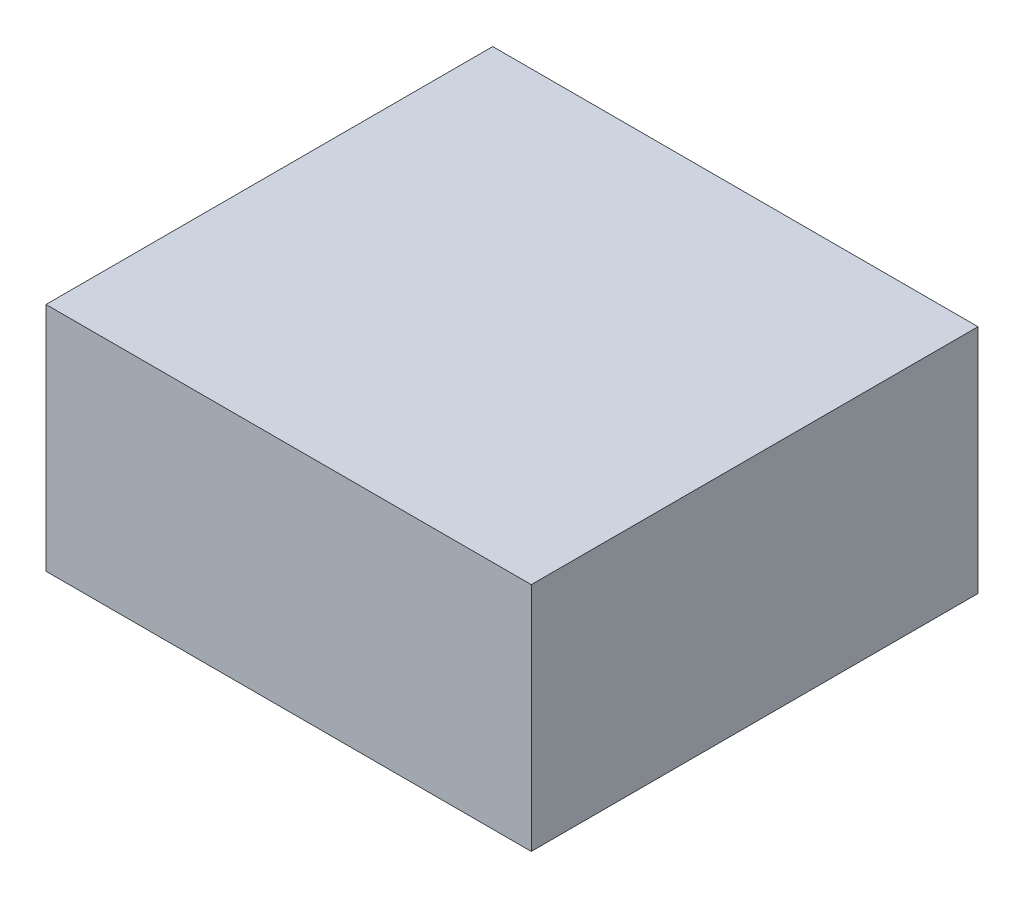
from build123d import *

# Parameters (mm, degrees)
SKETCH_1_W      = 63
SKETCH_1_H      = 58
EXTRUDE_1_DEPTH = 30


with BuildPart() as part:
    # Эскиз1 → Бобышка-Вытянуть1 (new body)
    with BuildSketch(Plane(origin=(0, 0, 0), x_dir=(1, 0, 0), z_dir=(0, 1, 0))):
        with Locations((31.5, -29)):
            Rectangle(SKETCH_1_W, SKETCH_1_H)
    extrude(amount=EXTRUDE_1_DEPTH)


solid = part.part
